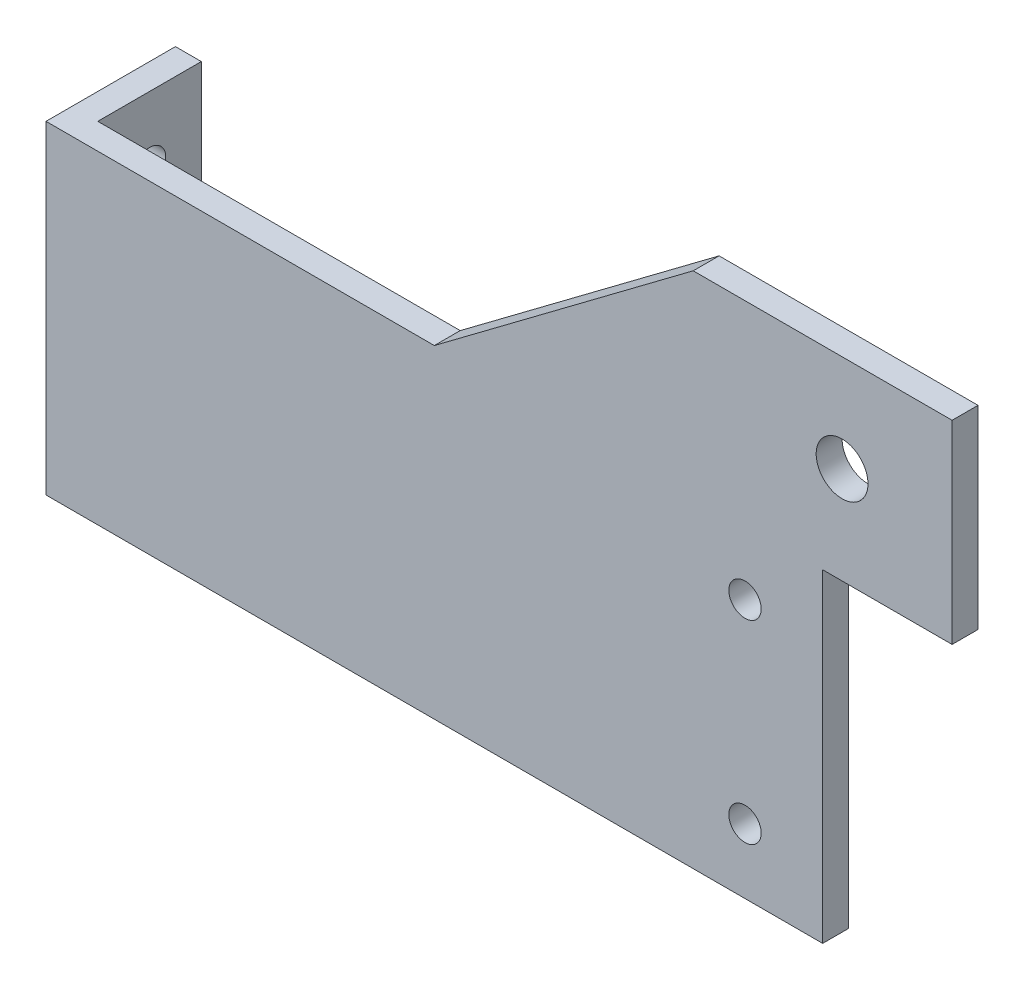
from build123d import *

# Parameters (mm, degrees)
EXTRUDE_1_DEPTH     = 80
SKETCH_2_R          = 2.5
CUT_EXTRUDE_1_DEPTH = 10
SKETCH_3_R          = 2.5
SKETCH_3_R_2        = 4
CUT_EXTRUDE_2_DEPTH = 10
CUT_EXTRUDE_3_DEPTH = 30
SKETCH_5_W          = 20
SKETCH_5_H          = 50
CUT_EXTRUDE_4_DEPTH = 10


with BuildPart() as part:
    # Эскиз1 → Бобышка-Вытянуть1 (new body)
    with BuildSketch(Plane(origin=(0, 0, 0), x_dir=(1, 0, 0), z_dir=(0, 1, 0))):
        Polygon((0, 0), (140, 0), (140, 4), (4, 4), (4, 20), (0, 20), (0, 4), align=None)
    extrude(amount=EXTRUDE_1_DEPTH)

    # Эскиз2 → Вырез-Вытянуть1 (cut)
    with BuildSketch(Plane.ZY):
        with Locations((-12, 40)):
            Circle(SKETCH_2_R)
        with Locations((-12, 10)):
            Circle(SKETCH_2_R)
    extrude(amount=-CUT_EXTRUDE_1_DEPTH, mode=Mode.SUBTRACT)

    # Эскиз3 → Вырез-Вытянуть2 (cut)
    with BuildSketch(Plane.XY):
        with Locations((108, 40)):
            Circle(SKETCH_3_R)
        with Locations((108, 10)):
            Circle(SKETCH_3_R)
        with Locations((123, 65)):
            Circle(SKETCH_3_R_2)
    extrude(amount=-CUT_EXTRUDE_2_DEPTH, mode=Mode.SUBTRACT)

    # Эскиз4 → Вырез-Вытянуть3 (cut)
    with BuildSketch(Plane.XY):
        Polygon((0, 50), (60, 50), (100, 80), (0, 80), align=None)
    extrude(amount=-CUT_EXTRUDE_3_DEPTH, mode=Mode.SUBTRACT)

    # Эскиз5 → Вырез-Вытянуть4 (cut)
    with BuildSketch(Plane.XY):
        with Locations((130, 25)):
            Rectangle(SKETCH_5_W, SKETCH_5_H)
    extrude(amount=-CUT_EXTRUDE_4_DEPTH, mode=Mode.SUBTRACT)


solid = part.part
